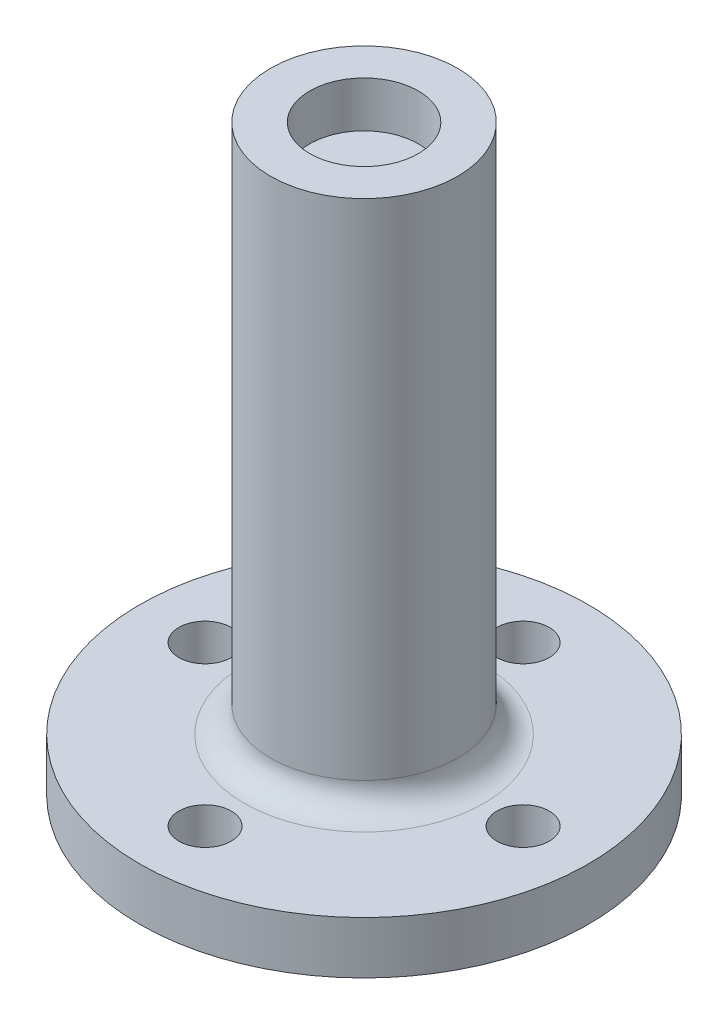
from build123d import *

# Parameters (mm, degrees)
SKETCH2_R          = 2
CUT_EXTRUDE1_DEPTH = 4


with BuildPart() as part:
    # Sketch1 → Revolve1 (revolve)
    with BuildSketch(Plane(origin=(0, 0, 0), x_dir=(0, 0, -1), z_dir=(1, 0, 0))):
        with BuildLine():
            Line((-7.15, 3.5), (-4.15, 3.5))
            Line((-4.15, 3.5), (-4.15, 0))
            Line((-4.15, 0), (0, 0))
            Line((0, 0), (0, -41))
            Line((0, -41), (-17.15, -41))
            Line((-17.15, -41), (-17.15, -37))
            Line((-17.15, -37), (-9.15, -37))
            ThreePointArc((-9.15, -37), (-7.735786438, -36.414213562), (-7.15, -35))
            Line((-7.15, -35), (-7.15, 3.5))
        make_face()
    revolve(axis=Axis((0, 0, 0), (0, -1, 0)))

    # Sketch2 → Cut-Extrude1 (cut)
    with BuildSketch(Plane(origin=(0, -37, 0), x_dir=(1, 0, 0), z_dir=(0, 1, 0))):
        with Locations(Location((0, 12.15, 0), (0, 0, 270))):
            Circle(SKETCH2_R)
        with Locations(Location((12.15, 0, 0), (0, 0, 270))):
            Circle(SKETCH2_R)
        with Locations(Location((0, -12.15, 0), (0, 0, 270))):
            Circle(SKETCH2_R)
        with Locations(Location((-12.15, 0, 0), (0, 0, 270))):
            Circle(SKETCH2_R)
    extrude(amount=-CUT_EXTRUDE1_DEPTH, mode=Mode.SUBTRACT)


solid = part.part
